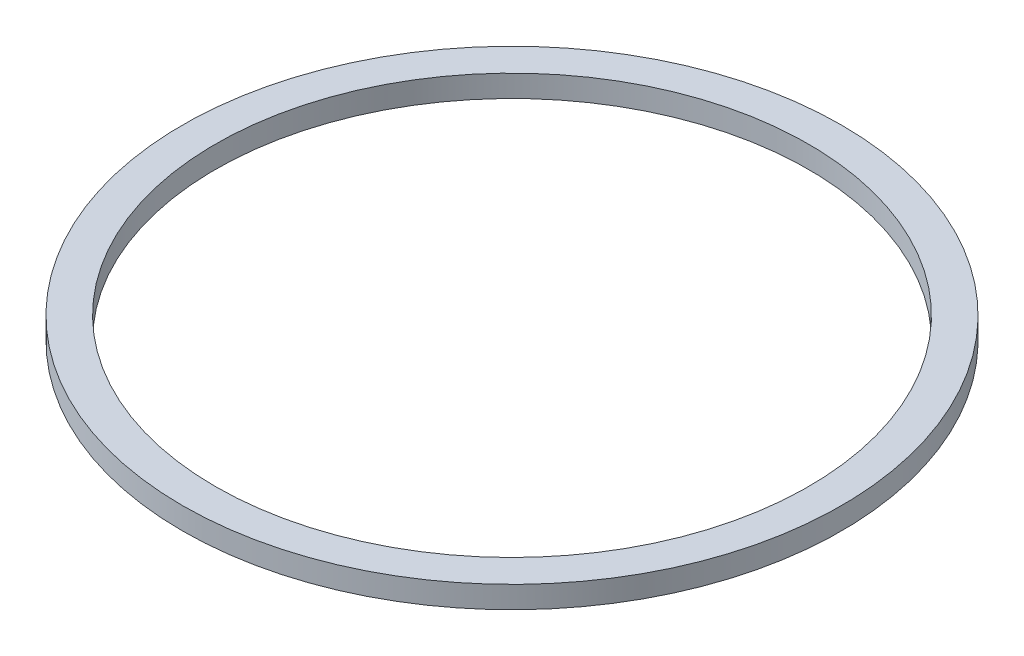
from build123d import *

# Parameters (mm, degrees)
ESQUISSE1_R        = 15
ESQUISSE1_R_2      = 13.5
BOSS_EXTRU_1_DEPTH = 1


with BuildPart() as part:
    # Esquisse1 → Boss.-Extru.1 (new body)
    with BuildSketch(Plane(origin=(0, 0, 0), x_dir=(1, 0, 0), z_dir=(0, 1, 0))):
        with Locations(Location((0, 0, 0), (0, 0, 270))):
            Circle(ESQUISSE1_R)
        with Locations(Location((0, 0, 0), (0, 0, 270))):
            Circle(ESQUISSE1_R_2, mode=Mode.SUBTRACT)
    extrude(amount=BOSS_EXTRU_1_DEPTH)


solid = part.part
